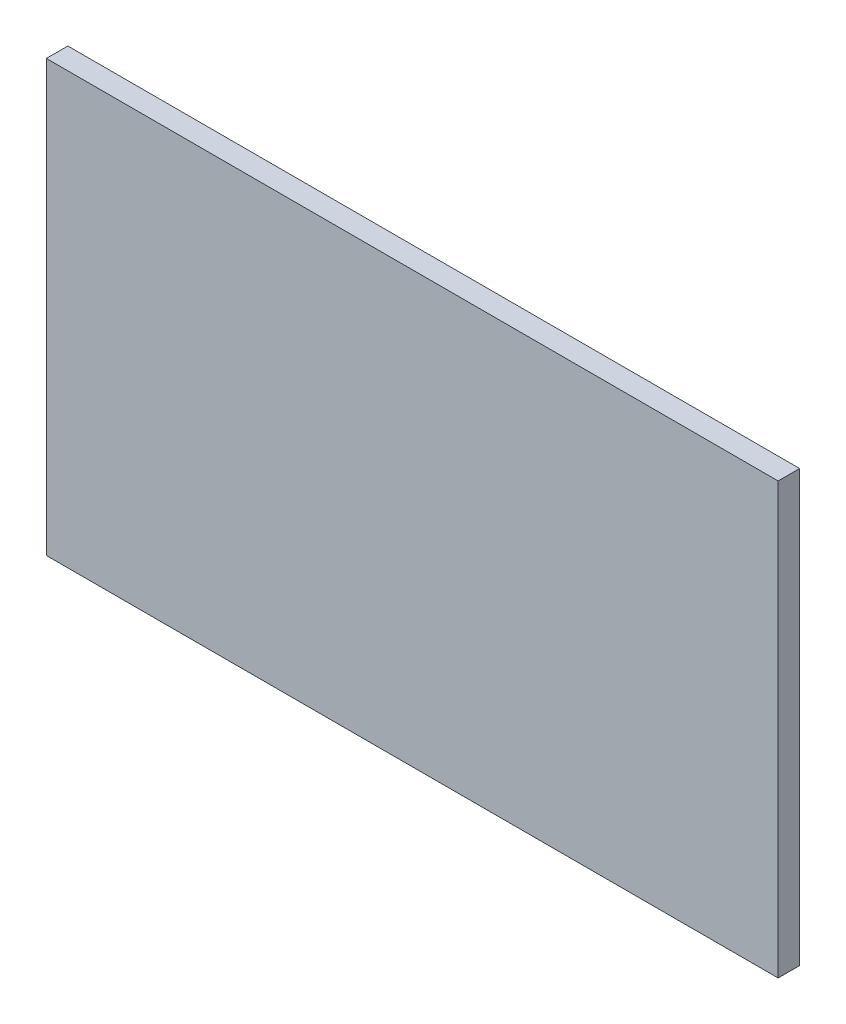
from build123d import *

# Parameters (mm, degrees)
ESQUISSE1_W        = 170
ESQUISSE1_H        = 100
BOSS_EXTRU_1_DEPTH = 5


with BuildPart() as part:
    # Esquisse1 → Boss.-Extru.1 (new body)
    with BuildSketch(Plane.XY):
        with Locations((85, 50)):
            Rectangle(ESQUISSE1_W, ESQUISSE1_H)
    extrude(amount=BOSS_EXTRU_1_DEPTH)


solid = part.part
